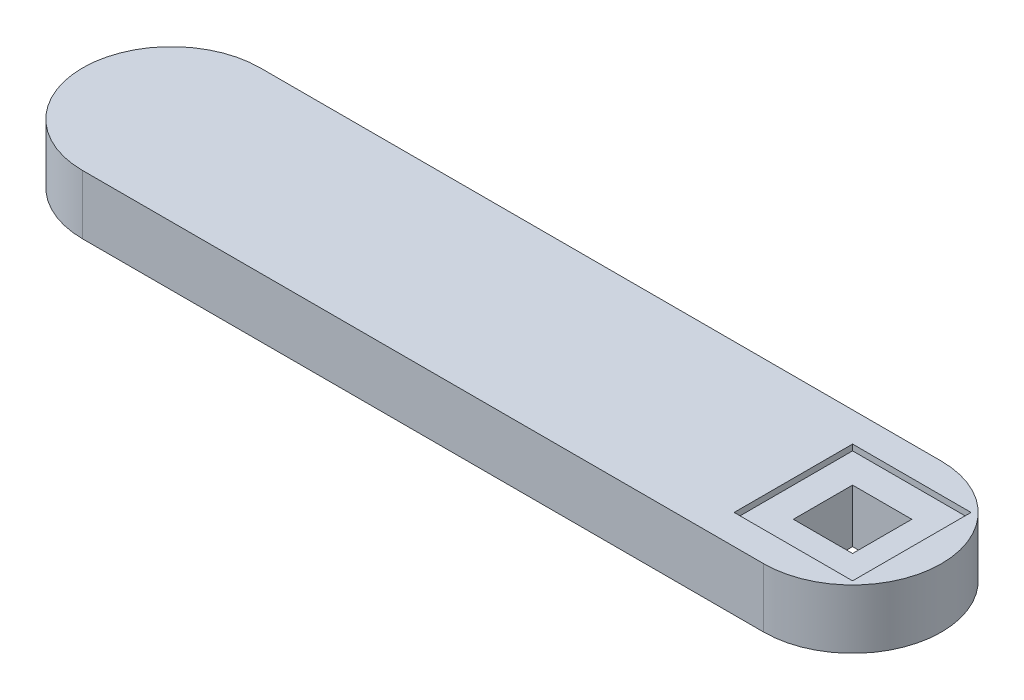
from build123d import *

# Parameters (mm, degrees)
BOSS_EXTRUDE1_DEPTH = 100
SKETCH3_R           = 50
BOSS_EXTRUDE3_DEPTH = 50
SKETCH2_W           = 100
SKETCH2_H           = 100
CUT_EXTRUDE1_DEPTH  = 100
SKETCH4_W           = 200
SKETCH4_H           = 200
CUT_EXTRUDE2_DEPTH  = 10


with BuildPart() as part:
    # Sketch1 → Boss-Extrude1 (new body)
    with BuildSketch(Plane(origin=(0, 0, 0), x_dir=(1, 0, 0), z_dir=(0, 1, 0))):
        with BuildLine():
            Line((0, 150), (1150, 150))
            ThreePointArc((1150, 150), (1300, 0), (1150, -150))
            Line((1150, -150), (0, -150))
            ThreePointArc((0, -150), (-150, 0), (0, 150))
        make_face()
    extrude(amount=BOSS_EXTRUDE1_DEPTH)

    # Sketch3 → Boss-Extrude3 (add)
    with BuildSketch(Plane.XZ):
        with Locations(Location((0, 0, 0), (0, 0, 90))):
            Circle(SKETCH3_R)
    extrude(amount=BOSS_EXTRUDE3_DEPTH)

    # Sketch2 → Cut-Extrude1 (cut)
    with BuildSketch(Plane(origin=(0, 100, 0), x_dir=(1, 0, 0), z_dir=(0, 1, 0))):
        with Locations((1150, 0)):
            Rectangle(SKETCH2_W, SKETCH2_H)
    extrude(amount=-CUT_EXTRUDE1_DEPTH, mode=Mode.SUBTRACT)

    # Sketch4 → Cut-Extrude2 (cut)
    with BuildSketch(Plane(origin=(0, 100, 0), x_dir=(1, 0, 0), z_dir=(0, 1, 0))):
        with Locations((1150, 0)):
            Rectangle(SKETCH4_W, SKETCH4_H)
    extrude(amount=-CUT_EXTRUDE2_DEPTH, mode=Mode.SUBTRACT)


solid = part.part
